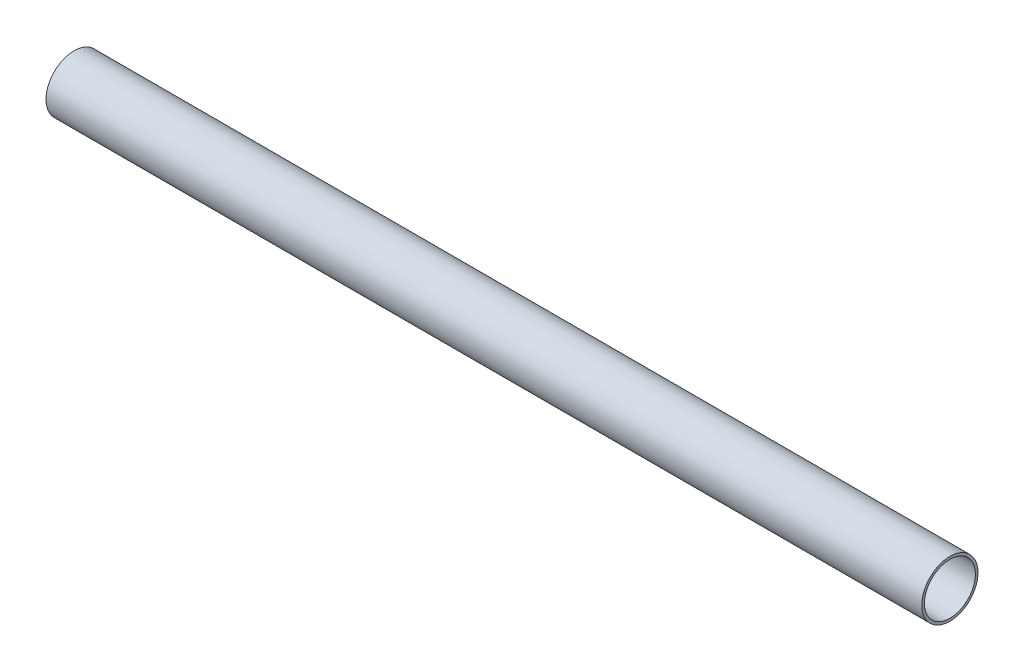
from build123d import *

# Parameters (mm, degrees)
SKETCH1_R           = 9.525
SKETCH1_R_2         = 8.636
BOSS_EXTRUDE1_DEPTH = 296.615918795


with BuildPart() as part:
    # Sketch1 → Boss-Extrude1 (new body)
    with BuildSketch(Plane(origin=(0, 0, 0), x_dir=(0, 0, -1), z_dir=(1, 0, 0))):
        with Locations(Location((0, 0, 0), (0, 0, 131.22806994))):
            Circle(SKETCH1_R)
        with Locations(Location((0, 0, 0), (0, 0, 131.22806994))):
            Circle(SKETCH1_R_2, mode=Mode.SUBTRACT)
    extrude(amount=BOSS_EXTRUDE1_DEPTH)


solid = part.part
